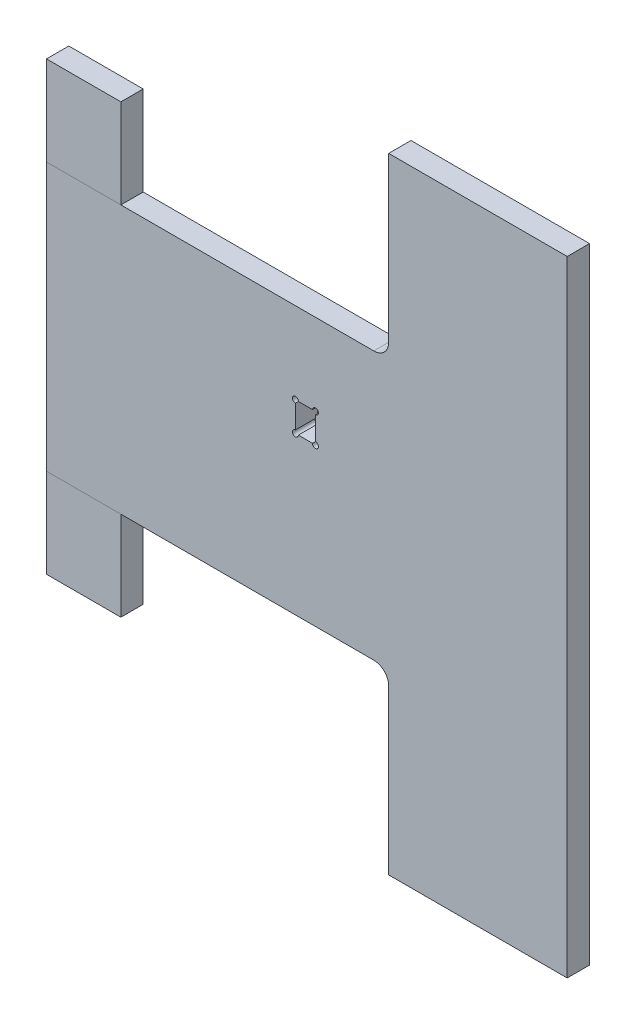
from build123d import *

# Parameters (mm, degrees)
SKETCH_1_W          = 400
SKETCH_1_H          = 180
EXTRUDE_1_DEPTH     = 15
SKETCH_3_W          = 9.5
SKETCH_3_H          = 15.6
CUT_EXTRUDE_2_DEPTH = 439.890646973
SKETCH_4_W          = 13.5
SKETCH_4_H          = 19.6
CUT_EXTRUDE_3_DEPTH = 439.890646973
SKETCH_5_R          = 2
CUT_EXTRUDE_4_DEPTH = 439.890646973
SKETCH_6_W          = 100
SKETCH_6_H          = 15
EXTRUDE_2_DEPTH     = 120
SKETCH_7_W          = 100
SKETCH_7_H          = 15
EXTRUDE_3_DEPTH     = 120
FILLET_1_R          = 10
SKETCH_8_W          = 50
SKETCH_8_H          = 180
CUT_EXTRUDE_5_DEPTH = 120
FILLET_2_R          = 10
SKETCH_9_W          = 50
SKETCH_9_H          = 15
EXTRUDE_4_DEPTH     = 60
SKETCH_10_W         = 50
SKETCH_10_H         = 15
EXTRUDE_5_DEPTH     = 60
SKETCH_11_W         = 20
SKETCH_11_H         = 120
EXTRUDE_6_DEPTH     = 15


with BuildPart() as part:
    # 草图1 → 凸台-拉伸1 (new body)
    with BuildSketch(Plane.XY):
        with Locations((200, 90)):
            Rectangle(SKETCH_1_W, SKETCH_1_H)
    extrude(amount=EXTRUDE_1_DEPTH)

    # 草图3 → 切除-拉伸2 (cut, through all)
    with BuildSketch(Plane.XY.offset(15)):
        with Locations((174.05, 115.45)):
            Rectangle(SKETCH_3_W, SKETCH_3_H)
    extrude(amount=-CUT_EXTRUDE_2_DEPTH, mode=Mode.SUBTRACT)

    # 草图4 → 切除-拉伸3 (cut, through all)
    with BuildSketch(Plane.XY.offset(15)):
        with Locations((174.05, 115.45)):
            Rectangle(SKETCH_4_W, SKETCH_4_H)
    extrude(amount=-CUT_EXTRUDE_3_DEPTH, mode=Mode.SUBTRACT)

    # 草图5 → 切除-拉伸4 (cut, through all)
    with BuildSketch(Plane.XY.offset(15)):
        with Locations((167.3, 125.25)):
            Circle(SKETCH_5_R)
        with Locations((167.3, 105.65)):
            Circle(SKETCH_5_R)
        with Locations((180.8, 105.65)):
            Circle(SKETCH_5_R)
        with Locations((180.8, 125.25)):
            Circle(SKETCH_5_R)
    extrude(amount=-CUT_EXTRUDE_4_DEPTH, mode=Mode.SUBTRACT)

    # 草图6 → 凸台-拉伸2 (add)
    with BuildSketch(Plane(origin=(0, 180, 0), x_dir=(1, 0, 0), z_dir=(0, 1, 0))):
        with Locations((280, -7.5)):
            Rectangle(SKETCH_6_W, SKETCH_6_H)
    extrude(amount=EXTRUDE_2_DEPTH)

    # 草图7 → 凸台-拉伸3 (add)
    with BuildSketch(Plane.XZ):
        with Locations((280, 7.5)):
            Rectangle(SKETCH_7_W, SKETCH_7_H)
    extrude(amount=EXTRUDE_3_DEPTH)

    # 圆角1
    fillet_1_edges = [part.edges().sort_by_distance(p)[0] for p in [
        (230, 0, 7.5),
        (230, 180, 7.5),
    ]]
    fillet(fillet_1_edges, radius=FILLET_1_R)

    # 草图8 → 切除-拉伸5 (cut)
    with BuildSketch(Plane.XY.offset(15)):
        with Locations((375, 90)):
            Rectangle(SKETCH_8_W, SKETCH_8_H)
    extrude(amount=-CUT_EXTRUDE_5_DEPTH, mode=Mode.SUBTRACT)

    # 圆角2
    fillet_2_edges = [part.edges().sort_by_distance(p)[0] for p in [
        (330, 0, 7.5),
        (330, 180, 7.5),
    ]]
    fillet(fillet_2_edges, radius=FILLET_2_R)

    # 草图11 → 凸台-拉伸6 (add)
    with BuildSketch(Plane.XY.offset(15)):
        with Locations((340, -60)):
            Rectangle(SKETCH_11_W, SKETCH_11_H)
        with Locations((340, 240)):
            Rectangle(SKETCH_11_W, SKETCH_11_H)
    extrude(amount=-EXTRUDE_6_DEPTH)


with BuildPart() as body_2:
    # 草图9 → 凸台-拉伸4 (new body)
    with BuildSketch(Plane(origin=(0, 180, 0), x_dir=(1, 0, 0), z_dir=(0, 1, 0))):
        with Locations((25, -7.5)):
            Rectangle(SKETCH_9_W, SKETCH_9_H)
    extrude(amount=EXTRUDE_4_DEPTH)


with BuildPart() as body_3:
    # 草图10 → 凸台-拉伸5 (new body)
    with BuildSketch(Plane.XZ):
        with Locations((25, 7.5)):
            Rectangle(SKETCH_10_W, SKETCH_10_H)
    extrude(amount=EXTRUDE_5_DEPTH)


solid = Compound([part.part, body_2.part, body_3.part])
